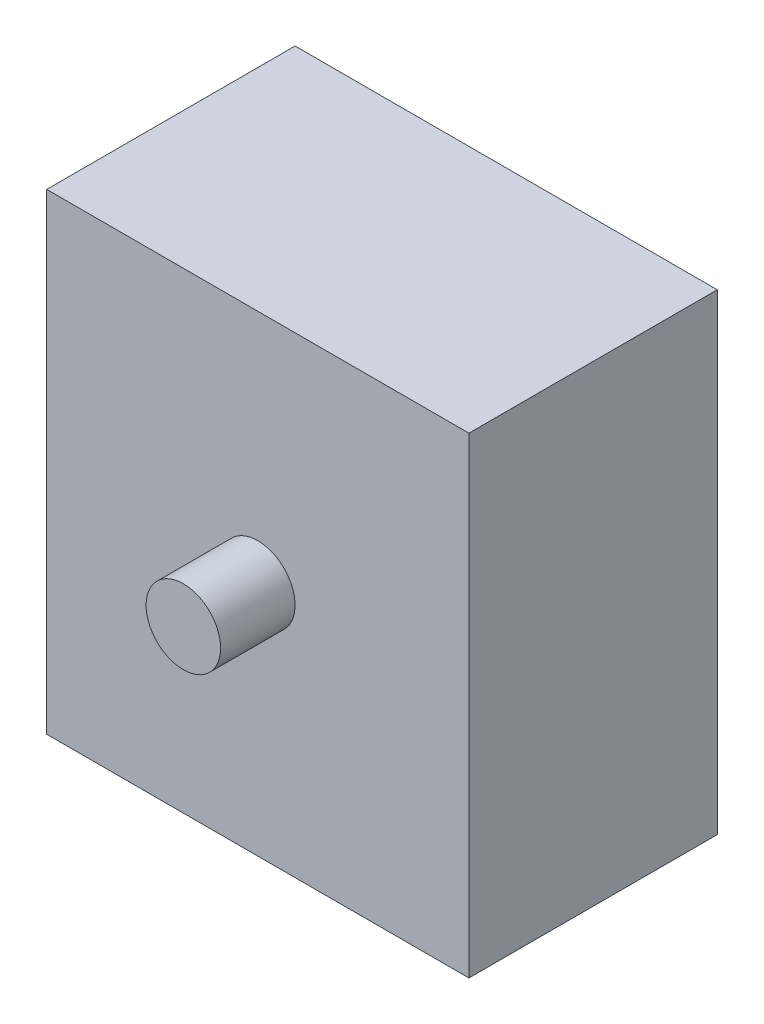
from build123d import *

# Parameters (mm, degrees)
SKETCH1_W           = 17
SKETCH1_H           = 19
BOSS_EXTRUDE1_DEPTH = 10
SKETCH3_R           = 1.5
BOSS_EXTRUDE2_DEPTH = 3


with BuildPart() as part:
    # Sketch1 → Boss-Extrude1 (new body)
    with BuildSketch(Plane.XY):
        Rectangle(SKETCH1_W, SKETCH1_H)
    extrude(amount=-BOSS_EXTRUDE1_DEPTH)

    # Sketch3 → Boss-Extrude2 (add)
    with BuildSketch(Plane.XY):
        with Locations(Location((0, 0, 0), (0, 0, 180))):
            Circle(SKETCH3_R)
    extrude(amount=BOSS_EXTRUDE2_DEPTH)


solid = part.part
